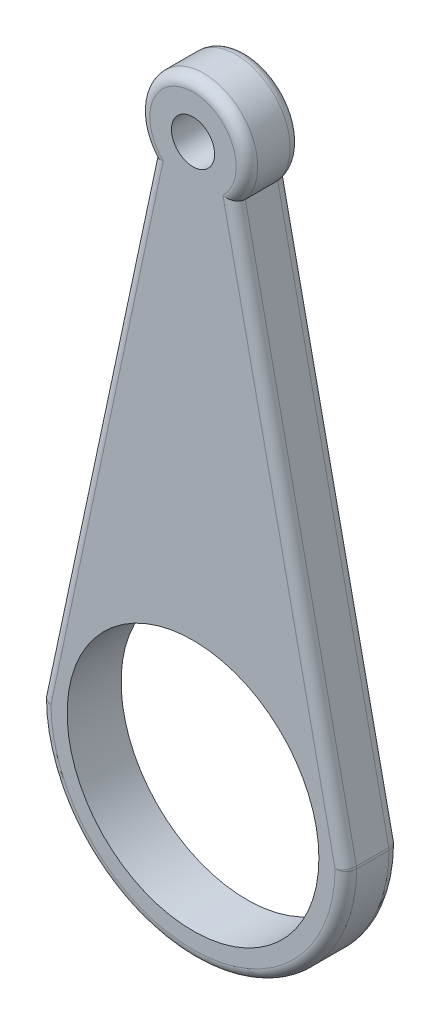
from build123d import *

# Parameters (mm, degrees)
SKETCH1_R           = 35
SKETCH1_R_2         = 6
BOSS_EXTRUDE1_DEPTH = 7.5
FILLET1_R           = 3


with BuildPart() as part:
    # Sketch1 → Boss-Extrude1 (new, symmetric)
    with BuildSketch(Plane.XY):
        with BuildLine():
            Line((-42.5, 0), (-11.544687954, 145.422934685))
            ThreePointArc((-11.544687954, 145.422934685), (0, 170), (11.544687954, 145.422934685))
            Line((11.544687954, 145.422934685), (42.5, 0))
            ThreePointArc((42.5, 0), (0, -42.5), (-42.5, 0))
        make_face()
        Circle(SKETCH1_R, mode=Mode.SUBTRACT)
        with Locations((0, 155)):
            Circle(SKETCH1_R_2, mode=Mode.SUBTRACT)
    extrude(amount=BOSS_EXTRUDE1_DEPTH, both=True)

    # Fillet1
    fillet1_edges = [part.edges().sort_by_distance(p)[0] for p in [
        (42.5, 0, 0),
        (-42.5, 0, 0),
        (27.022343977, 72.711467343, 7.5),
        (0, 170, 7.5),
        (-27.022343977, 72.711467343, 7.5),
        (0, -42.5, 7.5),
        (0, -42.5, -7.5),
        (-27.022343977, 72.711467343, -7.5),
        (0, 170, -7.5),
        (27.022343977, 72.711467343, -7.5),
    ]]
    fillet(fillet1_edges, radius=FILLET1_R)


solid = part.part
